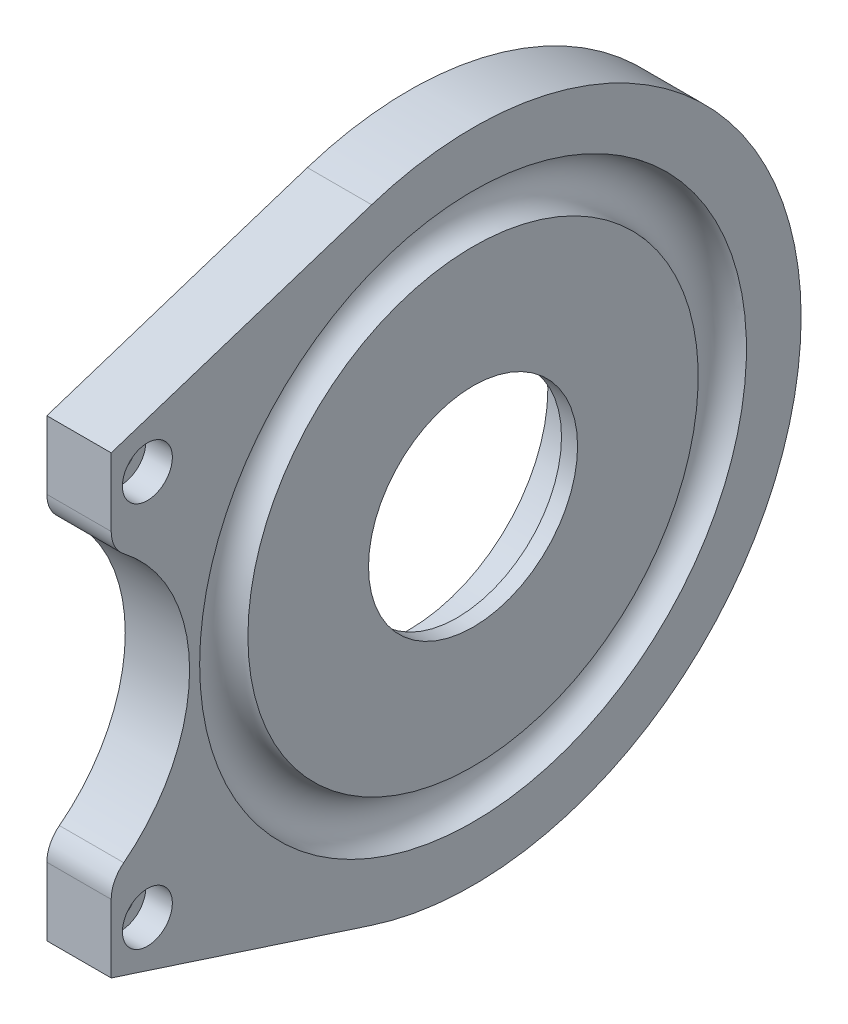
from build123d import *

# Parameters (mm, degrees)
EXTRUDE_1_DEPTH     = 8
SKETCH_4_R          = 3.105
CUT_EXTRUDE_1_DEPTH = 3.3
SKETCH_5_R          = 1.65
CUT_EXTRUDE_2_DEPTH = 61.923969011
SKETCH_6_R          = 17.3
CUT_EXTRUDE_3_DEPTH = 6
SKETCH_7_R          = 13
CUT_EXTRUDE_4_DEPTH = 62.038020938


with BuildPart() as part:
    # 草图1 → 凸台-拉伸1 (new body)
    with BuildSketch(Plane(origin=(0, 0, 0), x_dir=(0, 0, -1), z_dir=(1, 0, 0))):
        with BuildLine():
            Line((-45, -19.810035336), (-45, -28.278272418))
            Line((-45, -28.278272418), (-12.60789337, -38.803105865))
            ThreePointArc((-12.60789337, -38.803105865), (40.8, 0), (-12.60789337, 38.803105865))
            Line((-12.60789337, 38.803105865), (-45, 28.278272418))
            Line((-45, 28.278272418), (-45, 19.810035336))
            ThreePointArc((-45, 19.810035336), (-44.588871689, 18.043683162), (-43.44, 16.640429682))
            ThreePointArc((-43.44, 16.640429682), (-35.25, 0), (-43.44, -16.640429682))
            ThreePointArc((-43.44, -16.640429682), (-44.588871689, -18.043683162), (-45, -19.810035336))
        make_face()
    extrude(amount=EXTRUDE_1_DEPTH)

    # 草图3 → 切除-旋转1 (revolve, cut)
    with BuildSketch(Plane(origin=(0, 0, 0), x_dir=(1, 0, 0), z_dir=(0, 1, 0)), mode=Mode.PRIVATE) as cut_revolve_1_sk:
        with BuildLine():
            Line((8, 34), (8, 28))
            ThreePointArc((8, 28), (5, 31), (8, 34))
        make_face()
    revolve(cut_revolve_1_sk.sketch.rotate(Axis((0, 0, 0), (1, 0, 0)), 180), axis=Axis((0, 0, 0), (1, 0, 0)), mode=Mode.SUBTRACT)

    # 草图4 → 切除-拉伸1 (cut)
    with BuildSketch(Plane(origin=(8, 0, 0), x_dir=(0, 0, -1), z_dir=(1, 0, 0))):
        with Locations((-40.5, -23.998774784)):
            Circle(SKETCH_4_R)
        with Locations(Location((-40.5, 23.998774784, 0), (0, 0, 180))):
            Circle(SKETCH_4_R)
    extrude(amount=-CUT_EXTRUDE_1_DEPTH, mode=Mode.SUBTRACT)

    # 草图5 → 切除-拉伸2 (cut, through all)
    with BuildSketch(Plane(origin=(4.7, 0, 0), x_dir=(0, 0, -1), z_dir=(1, 0, 0))):
        with Locations((-40.5, -23.998774784)):
            Circle(SKETCH_5_R)
        with Locations(Location((-40.5, 23.998774784, 0), (0, 0, 180))):
            Circle(SKETCH_5_R)
    extrude(amount=-CUT_EXTRUDE_2_DEPTH, mode=Mode.SUBTRACT)

    # 草图6 → 切除-拉伸3 (cut)
    with BuildSketch(Plane.ZY):
        Circle(SKETCH_6_R)
    extrude(amount=-CUT_EXTRUDE_3_DEPTH, mode=Mode.SUBTRACT)

    # 草图7 → 切除-拉伸4 (cut, through all)
    with BuildSketch(Plane.ZY.offset(-6)):
        Circle(SKETCH_7_R)
    extrude(amount=-CUT_EXTRUDE_4_DEPTH, mode=Mode.SUBTRACT)


solid = part.part
